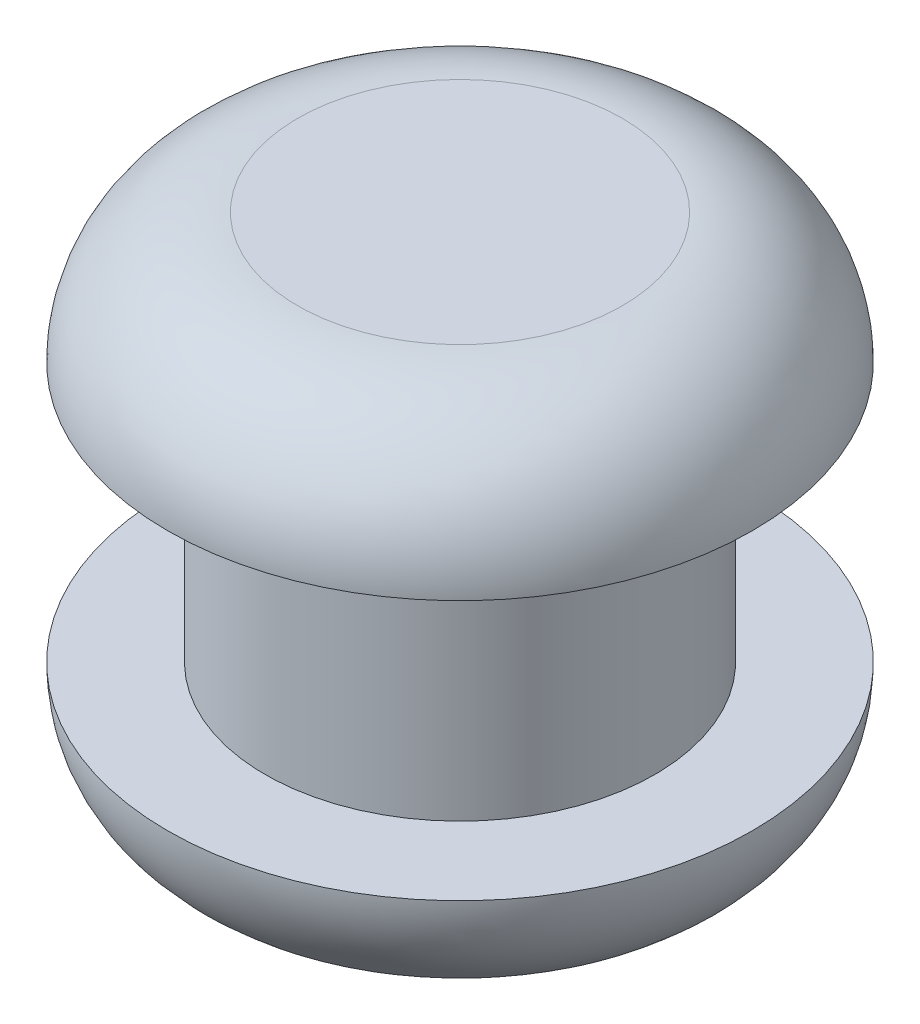
from build123d import *


with BuildPart() as part:
    # Sketch2 → Revolve1 (revolve)
    with BuildSketch(Plane.YZ, mode=Mode.PRIVATE) as revolve1_sk:
        with BuildLine():
            Line((-2, 3), (2, 3))
            Line((2, 3), (2, 4.5))
            ThreePointArc((2, 4.5), (3.414213562, 3.914213562), (4, 2.5))
            Line((4, 2.5), (4, 0))
            Line((4, 0), (-4, 0))
            Line((-4, 0), (-4, 2.5))
            ThreePointArc((-4, 2.5), (-3.414213562, 3.914213562), (-2, 4.5))
            Line((-2, 4.5), (-2, 3))
        make_face()
    revolve(revolve1_sk.sketch.rotate(Axis((0, -8.546595011, 0), (0, 1, 0)), 180), axis=Axis((0, -8.546595011, 0), (0, 1, 0)))


solid = part.part
